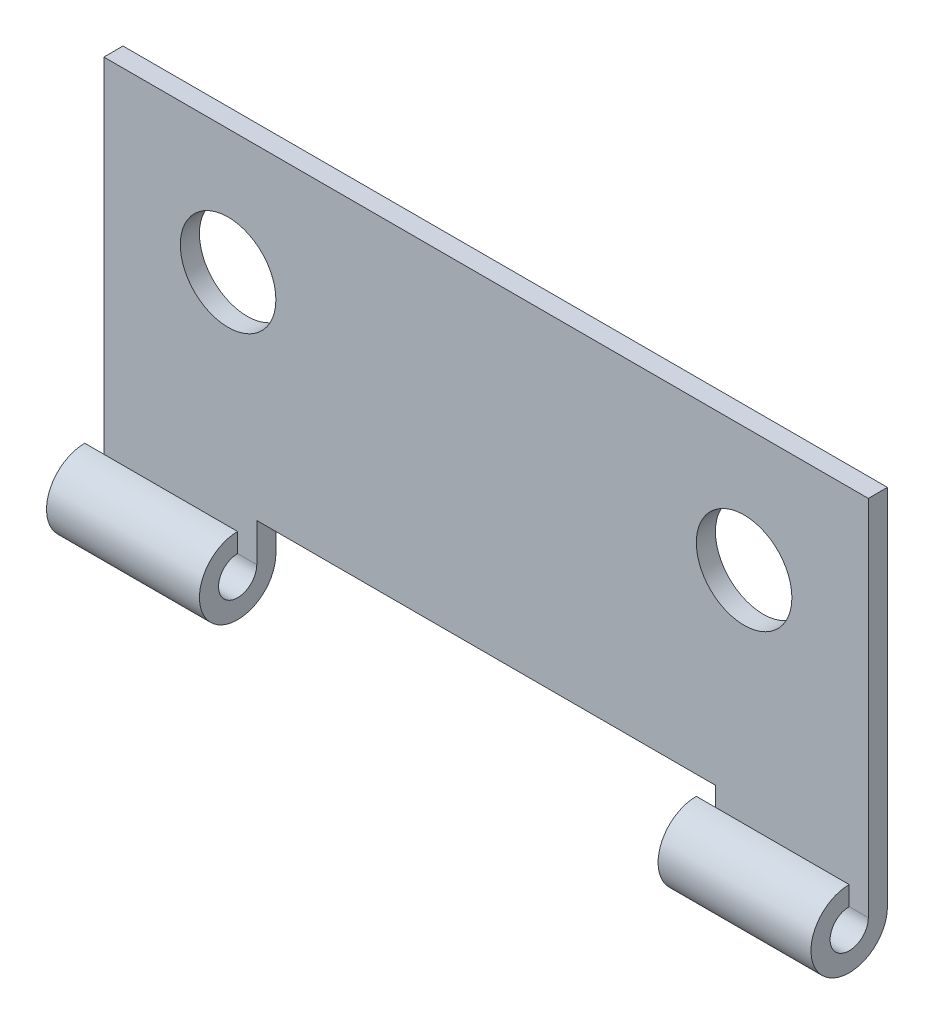
from build123d import *

# Parameters (mm, degrees)
ESQUISSE1_W             = 40
ESQUISSE1_H             = 17
BOSS_EXTRU_1_DEPTH      = 1
ENL_V_MAT_EXTRU_1_REACH = 45.474
ESQUISSE2_R             = 2.5
BOSS_EXTRU_2_DEPTH      = 8


with BuildPart() as part:
    # Esquisse1 → Boss.-Extru.1 (new body)
    with BuildSketch(Plane.XY):
        with Locations((20, 8.5)):
            Rectangle(ESQUISSE1_W, ESQUISSE1_H)
    extrude(amount=BOSS_EXTRU_1_DEPTH)

    # Esquisse2 → Enlèv. mat.-Extru.1 (cut, up to next)
    with BuildSketch(Plane.XY.offset(1), mode=Mode.PRIVATE) as enl_v_mat_extru_1_sk1:
        with Locations((6.5, 10.5)):
            Circle(ESQUISSE2_R)
    enl_v_mat_extru_1_tool1 = extrude(enl_v_mat_extru_1_sk1.sketch, amount=-ENL_V_MAT_EXTRU_1_REACH, mode=Mode.PRIVATE) & part.part
    # Esquisse2 → Enlèv. mat.-Extru.1 (cut, up to next)
    with BuildSketch(Plane.XY.offset(1), mode=Mode.PRIVATE) as enl_v_mat_extru_1_sk2:
        with Locations((33.5, 10.5)):
            Circle(ESQUISSE2_R)
    enl_v_mat_extru_1_tool2 = extrude(enl_v_mat_extru_1_sk2.sketch, amount=-ENL_V_MAT_EXTRU_1_REACH, mode=Mode.PRIVATE) & part.part
    add(enl_v_mat_extru_1_tool1.solids().sort_by_distance((6.5, 10.5, 1))[0], mode=Mode.SUBTRACT)
    add(enl_v_mat_extru_1_tool2.solids().sort_by_distance((33.5, 10.5, 1))[0], mode=Mode.SUBTRACT)

    # Esquisse3 → Boss.-Extru.2 (add)
    with BuildSketch(Plane.ZY.offset(-8)):
        with BuildLine():
            Line((0, 0), (0, -2))
            ThreePointArc((0, -2), (3.414213562, -3.414213562), (2, 0))
            Line((2, 0), (2, -1))
            ThreePointArc((2, -1), (2.707106781, -2.707106781), (1, -2))
            Line((1, -2), (1, 0))
            Line((1, 0), (0, 0))
        make_face()
    boss_extru_2 = extrude(amount=BOSS_EXTRU_2_DEPTH)

    # Symétrie1: Boss.-Extru.2 across plane
    add(boss_extru_2.mirror(Plane.ZY.offset(-20)))


solid = part.part
